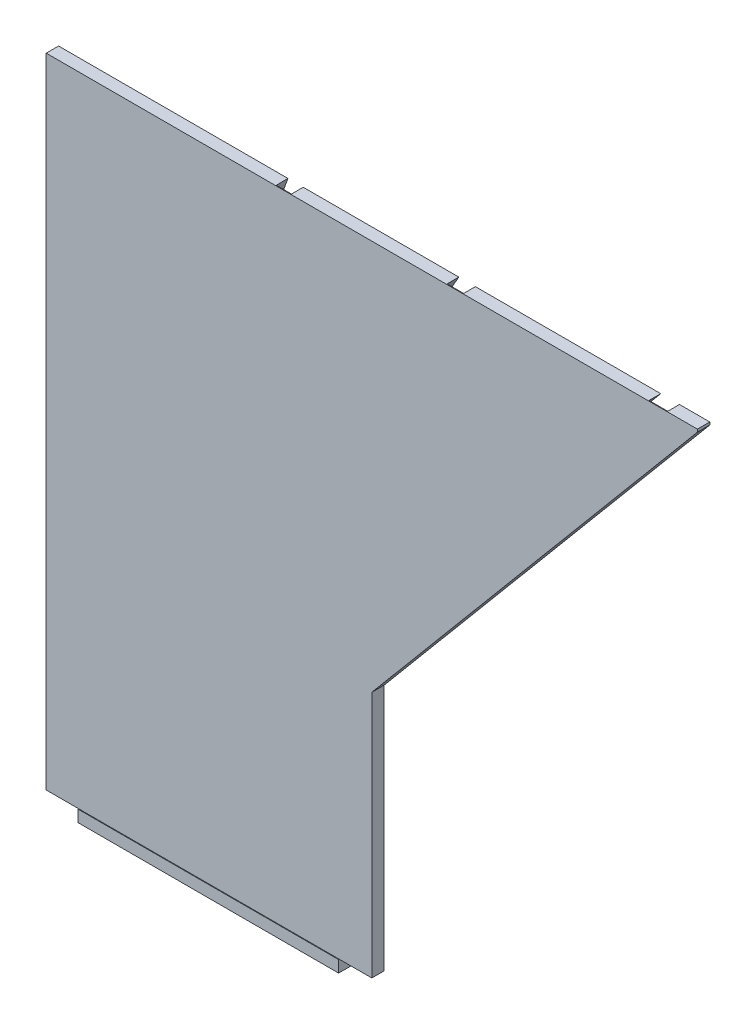
from build123d import *

# Parameters (mm, degrees)
BOSS_EXTRUDE1_DEPTH = 1.9
SKETCH6_W           = 40
SKETCH6_H           = 2
BOSS_EXTRUDE6_DEPTH = 0.1
CHAMFER2_SIZE       = 0.2
BOSS_EXTRUDE7_DEPTH = 0.1


with BuildPart() as part:
    # Sketch1 → Boss-Extrude1 (new body)
    with BuildSketch(Plane.XY):
        Polygon((-36.312345137, -37.152540378), (-38.217601025, -36.052540378), (11.464856327, 50), (-12.432381024, 50), (-46.771329023, -44.345484236), (-48.838652789, -43.593039921), (-14.773572123, 50), (-50, 50), (-50, -48), (-45, -48), (-45, -50), (-5, -50), (-5, -48), (0, -48), (0, -10), (50, 49.58767963), (50, 50), (45.345911136, 50), (-19.526148963, -27.311510683), (-21.211446738, -25.897377941), (42.474015099, 50), (14.005197511, 50), align=None)
    extrude(amount=BOSS_EXTRUDE1_DEPTH)

    # Sketch6 → Boss-Extrude6 (add)
    with BuildSketch(Plane.XY.offset(1.9)):
        with Locations((-25, -49)):
            Rectangle(SKETCH6_W, SKETCH6_H)
    extrude(amount=BOSS_EXTRUDE6_DEPTH)

    # Chamfer2
    chamfer2_edges = [part.edges().sort_by_distance(p)[0] for p in [
        (-25, -50, 0),
        (-5, -50, 1),
        (-45, -50, 1),
        (-25, -50, 2),
    ]]
    chamfer(chamfer2_edges, length=CHAMFER2_SIZE)

    # Sketch9 → Boss-Extrude7 (add)
    with BuildSketch(Plane.XY.offset(1.9)):
        Polygon((-14.773572123, 50), (-12.432381024, 50), (-46.771329023, -44.345484236), (-48.838652789, -43.593039921), align=None)
        Polygon((11.464856327, 50), (14.005197511, 50), (-36.312345137, -37.152540378), (-38.217601025, -36.052540378), align=None)
        Polygon((42.474015099, 50), (45.345911136, 50), (-19.526148963, -27.311510683), (-21.211446738, -25.897377941), align=None)
    extrude(amount=-BOSS_EXTRUDE7_DEPTH)


solid = part.part
